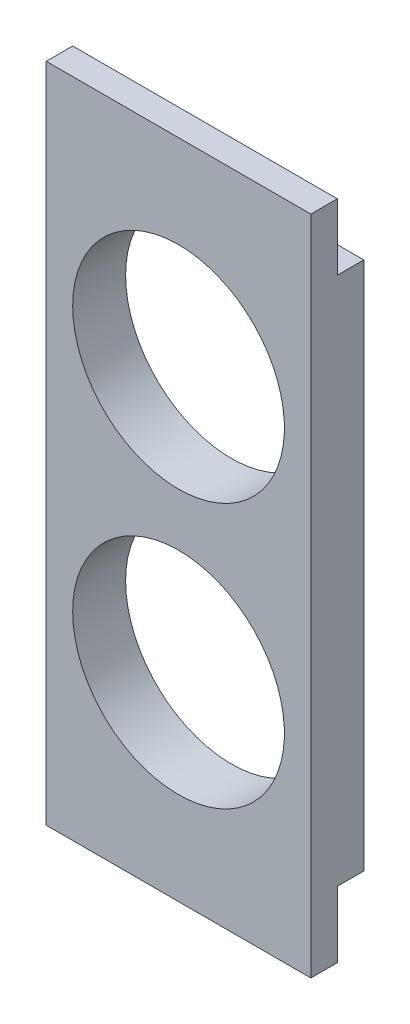
from build123d import *

# Parameters (mm, degrees)
SKETCH_1_W          = 100
SKETCH_1_H          = 200
SKETCH_1_R          = 40
EXTRUDE_1_DEPTH     = 10
SKETCH_2_W          = 100
SKETCH_2_H          = 250
EXTRUDE_2_DEPTH     = 10
SKETCH_3_R          = 40
CUT_EXTRUDE_1_DEPTH = 136


with BuildPart() as part:
    # 草图1 → 凸台-拉伸1 (new body)
    with BuildSketch(Plane.XY):
        Rectangle(SKETCH_1_W, SKETCH_1_H)
        with Locations((0, 50)):
            Circle(SKETCH_1_R, mode=Mode.SUBTRACT)
        with Locations(Location((0, -50, 0), (0, 0, 180))):
            Circle(SKETCH_1_R, mode=Mode.SUBTRACT)
    extrude(amount=EXTRUDE_1_DEPTH)

    # 草图2 → 凸台-拉伸2 (add)
    with BuildSketch(Plane.XY.offset(10)):
        Rectangle(SKETCH_2_W, SKETCH_2_H)
    extrude(amount=EXTRUDE_2_DEPTH)

    # 草图3 → 切除-拉伸1 (cut, through all)
    with BuildSketch(Plane(origin=(0, 0, 10), x_dir=(-1, 0, 0), z_dir=(0, 0, -1))):
        with Locations((0, 50)):
            Circle(SKETCH_3_R)
        with Locations((0, -50)):
            Circle(SKETCH_3_R)
    extrude(amount=-CUT_EXTRUDE_1_DEPTH, mode=Mode.SUBTRACT)


solid = part.part
